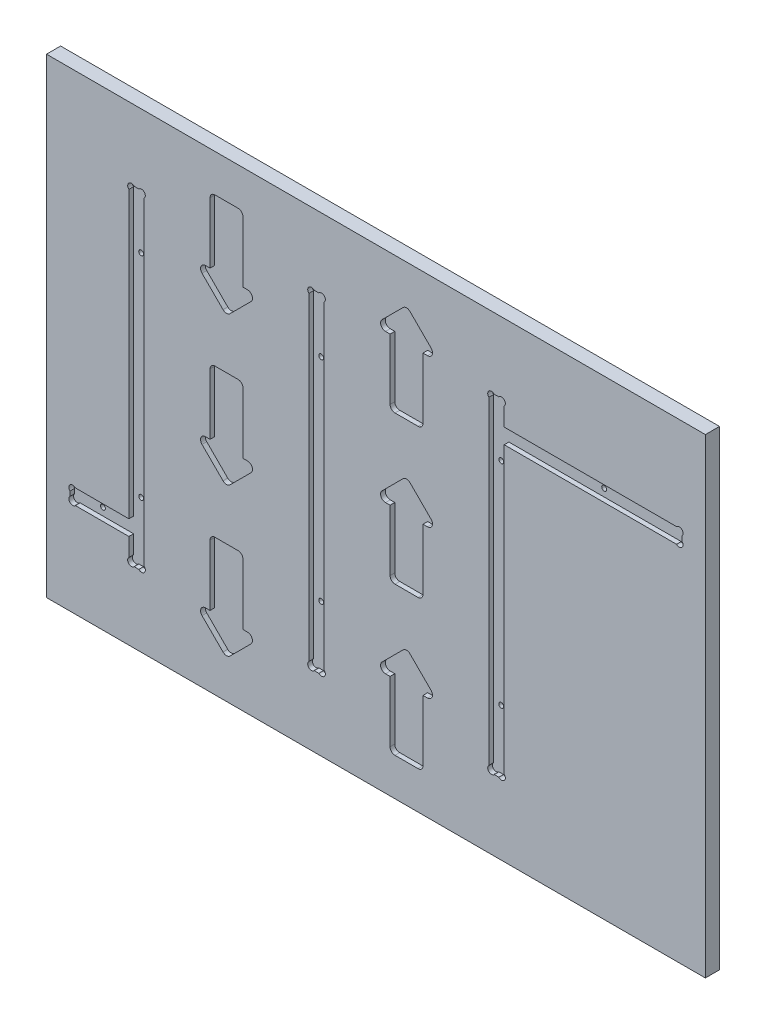
from build123d import *

# Parameters (mm, degrees)
ESQUISSE1_W             = 280
ESQUISSE1_H             = 200
EXTRUSION1_DEPTH        = 6
ESQUISSE2_W             = 6.5
ESQUISSE2_H             = 140
ENL_V_MAT_EXTRU_1_DEPTH = 2
ESQUISSE3_R             = 1.6
ENL_V_MAT_EXTRU_2_DEPTH = 2
ENL_V_MAT_EXTRU_4_DEPTH = 2
CONG_1_R                = 2.1
ESQUISSE6_W             = 25
ESQUISSE6_H             = 6.5
ESQUISSE6_W_2           = 75.5
ENL_V_MAT_EXTRU_5_DEPTH = 2
ESQUISSE7_R             = 1.6
ENL_V_MAT_EXTRU_6_DEPTH = 2
ESQUISSE4_R             = 1.05
ENL_V_MAT_EXTRU_3_DEPTH = 273.095571445


with BuildPart() as part:
    # Esquisse1 → Extrusion1 (new body)
    with BuildSketch(Plane.XY):
        with Locations((80, -60)):
            Rectangle(ESQUISSE1_W, ESQUISSE1_H)
    extrude(amount=EXTRUSION1_DEPTH)

    # Esquisse2 → Enlèv. mat.-Extru.1 (cut)
    with BuildSketch(Plane.XY.offset(6)):
        with Locations((-21.75, -60)):
            Rectangle(ESQUISSE2_W, ESQUISSE2_H)
        with Locations((54.75, -60)):
            Rectangle(ESQUISSE2_W, ESQUISSE2_H)
        with Locations((131.25, -60)):
            Rectangle(ESQUISSE2_W, ESQUISSE2_H)
    extrude(amount=-ENL_V_MAT_EXTRU_1_DEPTH, mode=Mode.SUBTRACT)

    # Esquisse3 → Enlèv. mat.-Extru.2 (cut)
    with BuildSketch(Plane.XY.offset(6)):
        with Locations((-23.9, 8.9)):
            Circle(ESQUISSE3_R)
        with Locations((-19.6, 8.9)):
            Circle(ESQUISSE3_R)
        with Locations((-23.9, -128.9)):
            Circle(ESQUISSE3_R)
        with Locations((-19.6, -128.9)):
            Circle(ESQUISSE3_R)
        with Locations((52.6, 8.9)):
            Circle(ESQUISSE3_R)
        with Locations((56.9, 8.9)):
            Circle(ESQUISSE3_R)
        with Locations((52.6, -128.9)):
            Circle(ESQUISSE3_R)
        with Locations((56.9, -128.9)):
            Circle(ESQUISSE3_R)
        with Locations((129.1, 8.9)):
            Circle(ESQUISSE3_R)
        with Locations((133.4, 8.9)):
            Circle(ESQUISSE3_R)
        with Locations((129.1, -128.9)):
            Circle(ESQUISSE3_R)
        with Locations((133.4, -128.9)):
            Circle(ESQUISSE3_R)
    extrude(amount=-ENL_V_MAT_EXTRU_2_DEPTH, mode=Mode.SUBTRACT)

    # Esquisse5 → Enlèv. mat.-Extru.4 (cut)
    with BuildSketch(Plane.XY.offset(6)):
        Polygon((86, -53), (86, -81), (100, -81), (100, -53), (107, -53), (93, -39), (79, -53), align=None)
        Polygon((86, -116), (86, -144), (100, -144), (100, -116), (107, -116), (93, -102), (79, -116), align=None)
        Polygon((86, 10), (86, -18), (100, -18), (100, 10), (107, 10), (93, 24), (79, 10), align=None)
        Polygon((9.5, -4), (2.5, -4), (16.5, -18), (30.5, -4), (23.5, -4), (23.5, 24), (9.5, 24), align=None)
        Polygon((9.5, -67), (2.5, -67), (16.5, -81), (30.5, -67), (23.5, -67), (23.5, -39), (9.5, -39), align=None)
        Polygon((9.5, -130), (2.5, -130), (16.5, -144), (30.5, -130), (23.5, -130), (23.5, -102), (9.5, -102), align=None)
    extrude(amount=-ENL_V_MAT_EXTRU_4_DEPTH, mode=Mode.SUBTRACT)

    # Congé1
    cong_1_edges = [part.edges().sort_by_distance(p)[0] for p in [
        (79, -116, 5),
        (93, -102, 5),
        (107, -116, 5),
        (100, -144, 5),
        (86, -144, 5),
        (9.5, 24, 5),
        (23.5, 24, 5),
        (30.5, -4, 5),
        (16.5, -18, 5),
        (2.5, -4, 5),
        (79, -53, 5),
        (93, -39, 5),
        (107, -53, 5),
        (100, -81, 5),
        (86, -81, 5),
        (79, 10, 5),
        (93, 24, 5),
        (107, 10, 5),
        (100, -18, 5),
        (86, -18, 5),
        (9.5, -39, 5),
        (23.5, -39, 5),
        (30.5, -67, 5),
        (16.5, -81, 5),
        (2.5, -67, 5),
        (9.5, -102, 5),
        (23.5, -102, 5),
        (30.5, -130, 5),
        (16.5, -144, 5),
        (2.5, -130, 5),
    ]]
    fillet(cong_1_edges, radius=CONG_1_R)

    # Esquisse6 → Enlèv. mat.-Extru.5 (cut)
    with BuildSketch(Plane.XY.offset(6)):
        with Locations((-37.5, -116.75)):
            Rectangle(ESQUISSE6_W, ESQUISSE6_H)
        with Locations((172.25, -3.25)):
            Rectangle(ESQUISSE6_W_2, ESQUISSE6_H)
    extrude(amount=-ENL_V_MAT_EXTRU_5_DEPTH, mode=Mode.SUBTRACT)

    # Esquisse7 → Enlèv. mat.-Extru.6 (cut)
    with BuildSketch(Plane.XY.offset(6)):
        with Locations((208.9, -1.1)):
            Circle(ESQUISSE7_R)
        with Locations((208.9, -5.4)):
            Circle(ESQUISSE7_R)
        with Locations((-48.9, -114.6)):
            Circle(ESQUISSE7_R)
        with Locations((-48.9, -118.9)):
            Circle(ESQUISSE7_R)
    extrude(amount=-ENL_V_MAT_EXTRU_6_DEPTH, mode=Mode.SUBTRACT)

    # Esquisse4 → Enlèv. mat.-Extru.3 (cut, through all)
    with BuildSketch(Plane.XY.offset(6)):
        with Locations((-21.75, -15)):
            Circle(ESQUISSE4_R)
        with Locations((-21.75, -105)):
            Circle(ESQUISSE4_R)
        with Locations((54.75, -15)):
            Circle(ESQUISSE4_R)
        with Locations((54.75, -105)):
            Circle(ESQUISSE4_R)
        with Locations((131.25, -15)):
            Circle(ESQUISSE4_R)
        with Locations((131.25, -105)):
            Circle(ESQUISSE4_R)
        with Locations((-38, -116.75)):
            Circle(ESQUISSE4_R)
        with Locations((175, -3.25)):
            Circle(ESQUISSE4_R)
    extrude(amount=-ENL_V_MAT_EXTRU_3_DEPTH, mode=Mode.SUBTRACT)


solid = part.part
